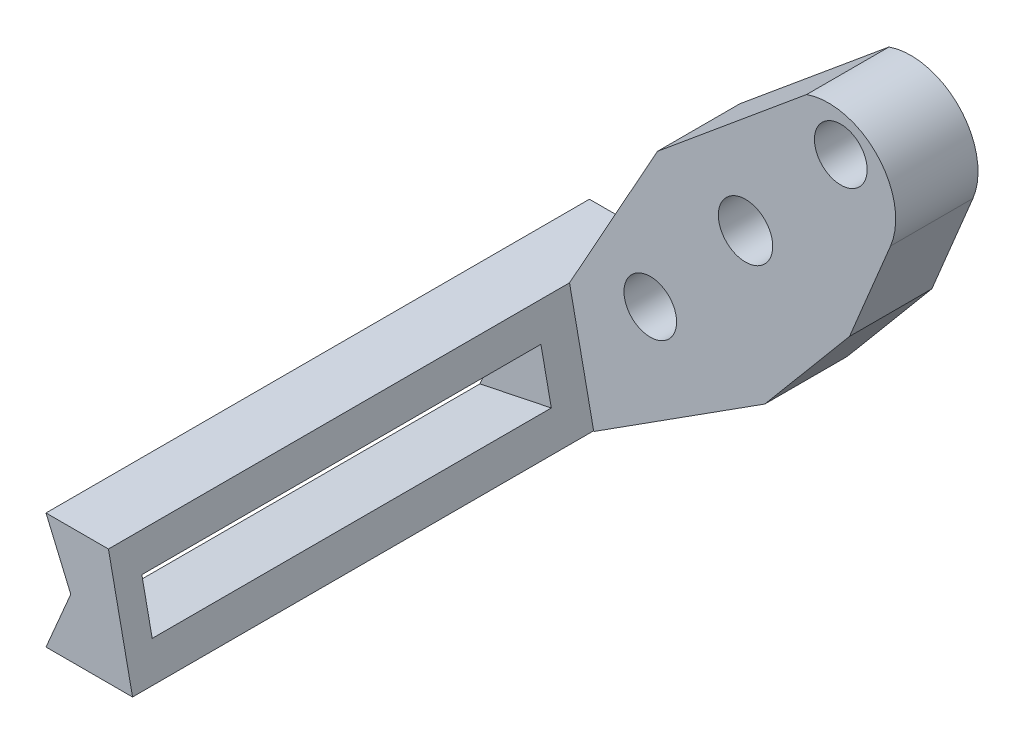
from build123d import *

# Parameters (mm, degrees)
CROQUIS1_R              = 1.600993429
CROQUIS1_R_2            = 1.650918845
CROQUIS1_R_3            = 1.598160281
SALIENTE_EXTRUIR1_DEPTH = 5
SALIENTE_EXTRUIR2_DEPTH = 28
CROQUIS3_W              = 24.234712775
CROQUIS3_H              = 3.1
CORTAR_EXTRUIR2_DEPTH   = 35


with BuildPart() as part:
    # Croquis1 → Saliente-Extruir1 (new body)
    with BuildSketch(Plane.XY):
        with BuildLine():
            Line((-19.813726886, 27.408212729), (-22.344749079, 27.408212729))
            Line((-22.344749079, 27.408212729), (-20.84194462, 23.881480403))
            Line((-20.84194462, 23.881480403), (-22.344749079, 20.354748078))
            Line((-22.344749079, 20.354748078), (-19.813726886, 20.354748078))
            Line((-19.813726886, 20.354748078), (-17.089167092, 20.354748078))
            ThreePointArc((-17.089167092, 20.354748078), (-17.073233268, 20.346247985), (-17.05726125, 20.337819881))
            Line((-17.05726125, 20.337819881), (-6.693946802, 26.960720035))
            Line((-6.693946802, 26.960720035), (-1.55164568, 33.089075871))
            Line((-1.55164568, 33.089075871), (0.94121729, 39.089722795))
            ThreePointArc((0.94121729, 39.089722795), (0.14668389, 43.447470603), (-4.153529562, 44.510209303))
            Line((-4.153529562, 44.510209303), (-13.213359782, 36.992537931))
            Line((-13.213359782, 36.992537931), (-18.553173623, 27.408212729))
            Line((-18.553173623, 27.408212729), (-19.813726886, 27.408212729))
        make_face()
        with Locations((-2.081556076, 42.38660259)):
            Circle(CROQUIS1_R, mode=Mode.SUBTRACT)
        with Locations((-7.865918923, 35.491404278)):
            Circle(CROQUIS1_R_2, mode=Mode.SUBTRACT)
        with Locations((-13.649232709, 28.598160609)):
            Circle(CROQUIS1_R_3, mode=Mode.SUBTRACT)
    extrude(amount=SALIENTE_EXTRUIR1_DEPTH)

    # Croquis2 → Saliente-Extruir2 (add)
    with BuildSketch(Plane.XY.offset(5)):
        Polygon((-22.344749079, 20.354748078), (-17.089167092, 20.354748078), (-18.553173623, 27.408212729), (-22.344749079, 27.408212729), (-20.84194462, 23.881480403), align=None)
    extrude(amount=SALIENTE_EXTRUIR2_DEPTH)

    # Croquis3 → Cortar-Extruir2 (cut)
    with BuildSketch(Plane(origin=(-12.33305174, -2.559829698, 0), x_dir=(0, 0, -1), z_dir=(0.9791316303558096, 0.2032270908042881, 0))):
        with Locations((-19.260916646, 27.056755515)):
            Rectangle(CROQUIS3_W, CROQUIS3_H)
    extrude(amount=-CORTAR_EXTRUIR2_DEPTH, mode=Mode.SUBTRACT)


solid = part.part
